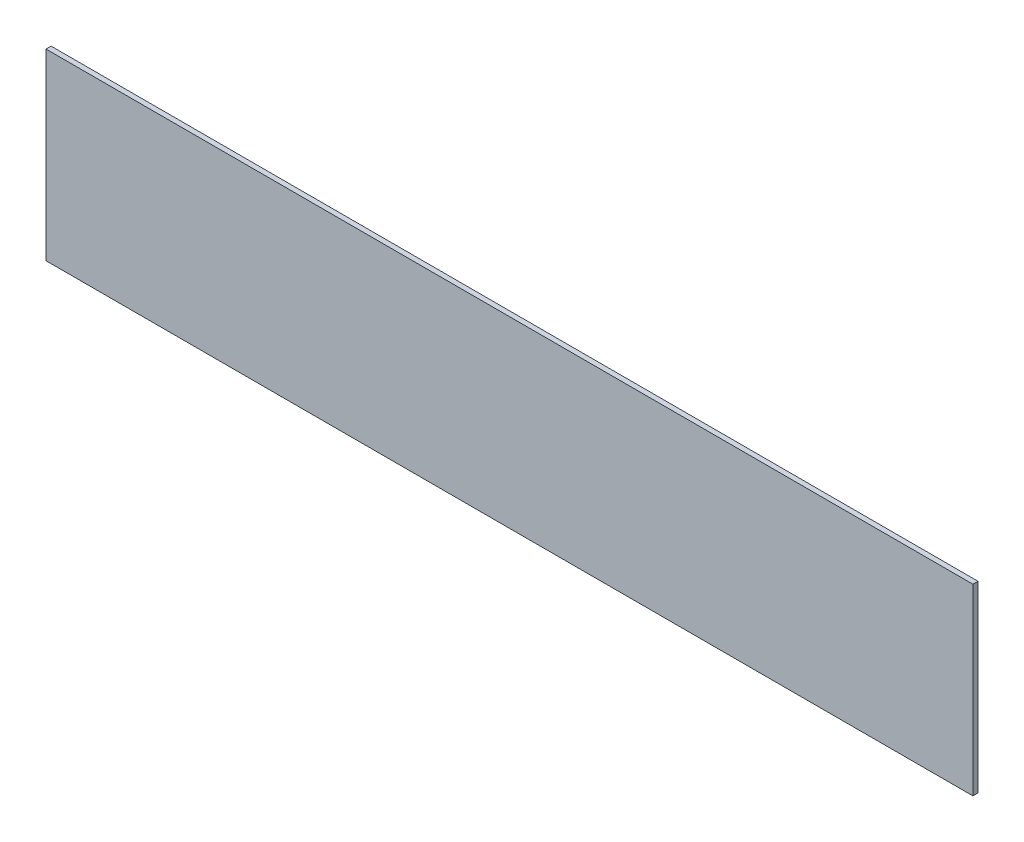
from build123d import *

# Parameters (mm, degrees)
STORE_KLAPE_KASET_KATI_KULP_CUKURU_1_START = 26
SKETCH1_W                                  = 182
SKETCH1_H                                  = 36
STORE_KLAPE_KASET_KATI_KULP_CUKURU_1_DEPTH = 1


with BuildPart() as part:
    # Sketch1 → STORE_klape_kaset_kati_kulp_cukuru_1 (new body)
    with BuildSketch(Plane.XY.offset(STORE_KLAPE_KASET_KATI_KULP_CUKURU_1_START)):
        with Locations((378, 641)):
            Rectangle(SKETCH1_W, SKETCH1_H)
    extrude(amount=STORE_KLAPE_KASET_KATI_KULP_CUKURU_1_DEPTH)


solid = part.part
